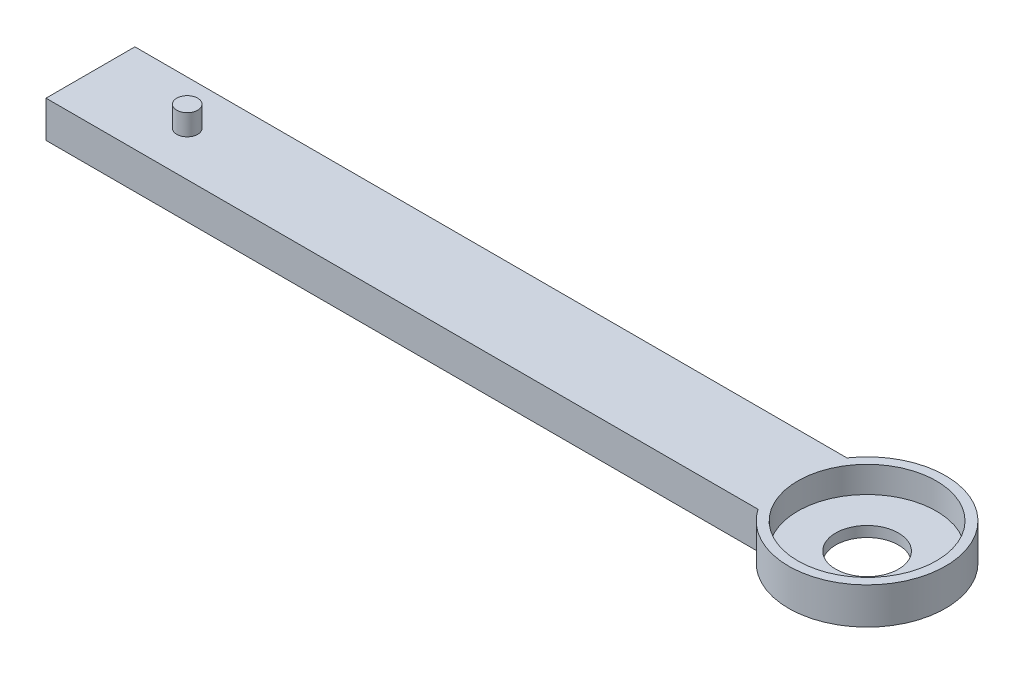
from build123d import *

# Parameters (mm, degrees)
SKETCH_3_W          = 148.5
SKETCH_3_H          = 7
EXTRUDE_1_DEPTH     = 17
SKETCH_4_R          = 15
CUT_EXTRUDE_3_DEPTH = 150.633719462
SKETCH_6_R          = 15
EXTRUDE_2_DEPTH     = 7
SKETCH_7_R          = 13.25
CUT_EXTRUDE_4_DEPTH = 5
SKETCH_8_R          = 6
CUT_EXTRUDE_5_DEPTH = 166.255862226
SKETCH_9_R          = 2
EXTRUDE_3_DEPTH     = 4
CUT_EXTRUDE_7_DEPTH = 1


with BuildPart() as part:
    # ｽｹｯﾁ3 → ﾎﾞｽ - 押し出し1 (new body)
    with BuildSketch(Plane.XY):
        with Locations((74.25, -3.5)):
            Rectangle(SKETCH_3_W, SKETCH_3_H)
    extrude(amount=EXTRUDE_1_DEPTH)

    # ｽｹｯﾁ4 → ｶｯﾄ - 押し出し3 (cut, through all)
    with BuildSketch(Plane(origin=(0, 0, 0), x_dir=(1, 0, 0), z_dir=(0, 1, 0))):
        with Locations((148.5, -8.5)):
            Circle(SKETCH_4_R)
    extrude(amount=-CUT_EXTRUDE_3_DEPTH, mode=Mode.SUBTRACT)

    # ｽｹｯﾁ6 → ﾎﾞｽ - 押し出し2 (add)
    with BuildSketch(Plane(origin=(0, 0, 0), x_dir=(1, 0, 0), z_dir=(0, 1, 0))):
        with Locations((148.5, -8.5)):
            Circle(SKETCH_6_R)
    extrude(amount=-EXTRUDE_2_DEPTH)

    # ｽｹｯﾁ7 → ｶｯﾄ - 押し出し4 (cut)
    with BuildSketch(Plane(origin=(0, 0, 0), x_dir=(1, 0, 0), z_dir=(0, 1, 0))):
        with Locations(Location((148.5, -8.5, 0), (0, 0, 270))):
            Circle(SKETCH_7_R)
    extrude(amount=-CUT_EXTRUDE_4_DEPTH, mode=Mode.SUBTRACT)

    # ｽｹｯﾁ8 → ｶｯﾄ - 押し出し5 (cut, through all)
    with BuildSketch(Plane(origin=(0, -5, 0), x_dir=(1, 0, 0), z_dir=(0, 1, 0))):
        with Locations(Location((148.5, -8.5, 0), (0, 0, 270))):
            Circle(SKETCH_8_R)
    extrude(amount=-CUT_EXTRUDE_5_DEPTH, mode=Mode.SUBTRACT)

    # ｽｹｯﾁ9 → ﾎﾞｽ - 押し出し3 (add)
    with BuildSketch(Plane(origin=(0, 0, 0), x_dir=(1, 0, 0), z_dir=(0, 1, 0))):
        with Locations(Location((18.5, -8.5, 0), (0, 0, 90))):
            Circle(SKETCH_9_R)
    extrude(amount=EXTRUDE_3_DEPTH)

    # ｽｹｯﾁ12 → ｶｯﾄ - 押し出し7 (cut)
    # profile 1 of 2: a face of its own
    with BuildSketch(Plane.XZ.offset(7)):
        with BuildLine():
            Line((8.222746092, 6.351907356), (8.90563872, 6.351907356))
            add(Edge.make_bspline(
                [(8.90563872, 6.351907356), (8.939067198, 6.351731606), (9.003859909, 6.351390958), (9.098079351, 6.346107827), (9.186328161, 6.338904157), (9.268631934, 6.327474064), (9.344952636, 6.313682287), (9.415520273, 6.296980471), (9.480110445, 6.276953857), (9.557223182, 6.245107576), (9.645143843, 6.197784408), (9.740342235, 6.127855843), (9.821746475, 6.042323379), (9.891932792, 5.945840724), (9.947733912, 5.839704952), (9.988103209, 5.726445764), (10.013661084, 5.607524022), (10.016289519, 5.525880844), (10.017617887, 5.484619696)],
                knots=[0, 0, 0, 0, 1.001505555, 1.941167018, 2.826882275, 3.653841531, 4.429895133, 5.150066043, 5.825578002, 6.45369114, 7.647487171, 8.808567382, 9.977351308, 11.170798116, 12.373658725, 13.556498008, 14.765093433, 16, 16, 16, 16], degree=3))
            add(Edge.make_bspline(
                [(10.017617887, 5.484619696), (10.016524668, 5.44596714), (10.014376391, 5.370011223), (9.993833632, 5.258917114), (9.961672963, 5.153165895), (9.916967714, 5.05314351), (9.858865718, 4.961109897), (9.790007399, 4.876322631), (9.706930597, 4.802371574), (9.644687357, 4.761028671), (9.613070611, 4.74002835)],
                knots=[0, 0, 0, 0, 1.044552857, 2.05264487, 3.044412934, 4.028983338, 5.005914585, 5.980388656, 6.974128949, 8, 8, 8, 8], degree=3))
            add(Edge.make_bspline(
                [(9.613070611, 4.74002835), (9.652831039, 4.724763351), (9.728902586, 4.695557627), (9.833588599, 4.643922163), (9.923783444, 4.587760052), (10.00018059, 4.526428202), (10.065518245, 4.460319391), (10.122571186, 4.388464277), (10.17125256, 4.309925519), (10.212965484, 4.225521984), (10.24551424, 4.136115515), (10.269890144, 4.042544739), (10.283857593, 3.945145184), (10.285845235, 3.878859805), (10.286848656, 3.84539694)],
                knots=[0, 0, 0, 0, 1.27268992, 2.434971085, 3.483601985, 4.442670788, 5.356604649, 6.2567628, 7.179492994, 8.113709626, 9.066344395, 10.018646069, 10.999752585, 12, 12, 12, 12], degree=3))
            add(Edge.make_bspline(
                [(10.286848656, 3.84539694), (10.28587181, 3.811230068), (10.283949838, 3.744005789), (10.269769866, 3.645250655), (10.245760759, 3.550875708), (10.212689613, 3.460270526), (10.169527298, 3.373610391), (10.116999334, 3.290797127), (10.05436777, 3.212662796), (9.984304901, 3.138339173), (9.905042756, 3.071511386), (9.819527001, 3.011995679), (9.726680681, 2.963049617), (9.628028687, 2.921933596), (9.522464371, 2.890526397), (9.410461764, 2.868553823), (9.292117462, 2.853748786), (9.210907711, 2.852531581), (9.169260515, 2.851907356)],
                knots=[0, 0, 0, 0, 0.978564426, 1.925352924, 2.850884081, 3.763762016, 4.682927383, 5.618979971, 6.567305752, 7.547517671, 8.540179244, 9.531824382, 10.526200242, 11.540722885, 12.589160233, 13.674978461, 14.80764778, 16, 16, 16, 16], degree=3))
            Line((9.169260515, 2.851907356), (8.222746092, 2.851907356))
            Line((8.222746092, 2.851907356), (8.222746092, 6.351907356))
        make_face()
        with BuildLine():
            Line((8.536848656, 5.992932997), (8.536848656, 4.871138126))
            Line((8.536848656, 4.871138126), (8.747886316, 4.871138126))
            add(Edge.make_bspline(
                [(8.747886316, 4.871138126), (8.778735112, 4.871538049), (8.838341271, 4.872310781), (8.924661168, 4.874524298), (9.004786186, 4.880722342), (9.078578019, 4.886918604), (9.145920463, 4.896993191), (9.206664324, 4.908985314), (9.261762921, 4.92166822), (9.325302467, 4.943237706), (9.397375415, 4.975115382), (9.474208519, 5.024587218), (9.541942989, 5.083511571), (9.599140177, 5.151502533), (9.645951647, 5.226368719), (9.678465362, 5.306915599), (9.700512647, 5.391135731), (9.702504178, 5.448953984), (9.703515323, 5.4783096)],
                knots=[0, 0, 0, 0, 1.156816544, 2.235205308, 3.236616184, 4.169592532, 5.011045266, 5.787822928, 6.49130361, 7.128639758, 8.301311294, 9.436451833, 10.541879658, 11.654887649, 12.756523258, 13.837046038, 14.901820046, 16, 16, 16, 16], degree=3))
            add(Edge.make_bspline(
                [(9.703515323, 5.4783096), (9.702989143, 5.497735371), (9.701956983, 5.535841144), (9.69350368, 5.591390498), (9.679136106, 5.64363425), (9.660681812, 5.693288361), (9.634893124, 5.738800211), (9.60452966, 5.781743406), (9.56784397, 5.820655525), (9.526086657, 5.857025023), (9.478078035, 5.889269551), (9.423846743, 5.917510314), (9.362659066, 5.940251091), (9.295546211, 5.960167243), (9.221475123, 5.974155537), (9.14130057, 5.985808925), (9.054365851, 5.991741667), (8.994220748, 5.99252703), (8.963130707, 5.992932997)],
                knots=[0, 0, 0, 0, 0.91205012, 1.789085906, 2.630437955, 3.453916878, 4.269457761, 5.079663411, 5.91843418, 6.774407191, 7.675494373, 8.627863946, 9.638891023, 10.736472738, 11.911756761, 13.175263542, 14.539845004, 16, 16, 16, 16], degree=3))
            Line((8.963130707, 5.992932997), (8.536848656, 5.992932997))
        make_face(mode=Mode.SUBTRACT)
        with BuildLine():
            Line((8.536848656, 4.512163767), (8.536848656, 3.210881715))
            Line((8.536848656, 3.210881715), (8.984164361, 3.210881715))
            add(Edge.make_bspline(
                [(8.984164361, 3.210881715), (9.016183287, 3.211265463), (9.077895546, 3.212005085), (9.166996776, 3.21441964), (9.24957988, 3.219911915), (9.325268015, 3.228557765), (9.394878468, 3.237936214), (9.457576171, 3.250547495), (9.513869364, 3.264996456), (9.579143672, 3.287330628), (9.652647181, 3.322027099), (9.731858037, 3.374341325), (9.802284255, 3.436664633), (9.862089514, 3.508795547), (9.911102503, 3.587226874), (9.946757958, 3.670372224), (9.968748815, 3.756857752), (9.971410984, 3.815824464), (9.972746092, 3.84539694)],
                knots=[0, 0, 0, 0, 1.160039823, 2.235823828, 3.228722157, 4.157150951, 4.99529583, 5.772374946, 6.472645482, 7.099169577, 8.269452708, 9.405989375, 10.527446681, 11.663510218, 12.788923519, 13.866172445, 14.929861265, 16, 16, 16, 16], degree=3))
            add(Edge.make_bspline(
                [(9.972746092, 3.84539694), (9.972469988, 3.86389028), (9.971922233, 3.900578662), (9.963661618, 3.954494481), (9.951647748, 4.006720354), (9.936116314, 4.057398095), (9.913496847, 4.105611471), (9.887090302, 4.152314031), (9.8561289, 4.19756751), (9.807884734, 4.254779764), (9.73771275, 4.320696777), (9.638005974, 4.385234279), (9.524633676, 4.437282086), (9.442406184, 4.459381562), (9.399929586, 4.470797581)],
                knots=[0, 0, 0, 0, 0.723448775, 1.435228256, 2.130040452, 2.821711965, 3.505591119, 4.210454504, 4.921174351, 5.648778258, 7.137944449, 8.670945889, 10.280296675, 12, 12, 12, 12], degree=3))
            add(Edge.make_bspline(
                [(9.399929586, 4.470797581), (9.38290049, 4.474252665), (9.345977897, 4.481743999), (9.285770317, 4.489651703), (9.217034448, 4.496696763), (9.139611571, 4.50190792), (9.05340373, 4.507294464), (8.958226811, 4.509389285), (8.854469496, 4.511888545), (8.782477124, 4.512069679), (8.745081829, 4.512163767)],
                knots=[0, 0, 0, 0, 0.634451884, 1.375622551, 2.216452059, 3.157844607, 4.20941857, 5.370758133, 6.634282058, 8, 8, 8, 8], degree=3))
            Line((8.745081829, 4.512163767), (8.536848656, 4.512163767))
        make_face(mode=Mode.SUBTRACT)
    # profile 2 of 2: a face of its own
    with BuildSketch(Plane.XZ.offset(7)):
        with BuildLine():
            Line((11.139412759, 5.274984279), (10.825310195, 5.274984279))
            add(Edge.make_bspline(
                [(10.825310195, 5.274984279), (10.827357348, 5.316655167), (10.831377902, 5.398495682), (10.850206191, 5.517819588), (10.877147068, 5.631874387), (10.915238522, 5.739744301), (10.9625448, 5.842383108), (11.019274827, 5.939383124), (11.086468678, 6.030374312), (11.162675412, 6.114513156), (11.245444051, 6.191700727), (11.33474999, 6.258355969), (11.428595018, 6.314673641), (11.526694417, 6.361754883), (11.63015498, 6.397094728), (11.738037838, 6.423316368), (11.850816974, 6.439092714), (11.927656996, 6.440788499), (11.966736477, 6.441650946)],
                knots=[0, 0, 0, 0, 1.10065271, 2.161652631, 3.183658789, 4.190468796, 5.17591951, 6.163126047, 7.15150782, 8.156236427, 9.156009102, 10.134482811, 11.092018607, 12.041330605, 13.001268258, 13.972401359, 14.968799086, 16, 16, 16, 16], degree=3))
            add(Edge.make_bspline(
                [(11.966736477, 6.441650946), (12.005114551, 6.44075249), (12.080526095, 6.438987055), (12.19058811, 6.423826026), (12.295365404, 6.400080434), (12.394653171, 6.366765018), (12.487659235, 6.32198059), (12.57508228, 6.268183052), (12.657963091, 6.20596322), (12.732569874, 6.132709407), (12.801077954, 6.054507022), (12.860180209, 5.971019119), (12.910793372, 5.884789833), (12.952981052, 5.795161631), (12.984037191, 5.701290603), (13.007615399, 5.6045434), (13.020942813, 5.503918589), (13.022988236, 5.435812033), (13.024028143, 5.401186202)],
                knots=[0, 0, 0, 0, 1.111607364, 2.184268762, 3.212621178, 4.221274766, 5.211760367, 6.196651075, 7.1921475, 8.207485113, 9.220403448, 10.201281604, 11.166441695, 12.114753415, 13.065576456, 14.026450734, 14.996634279, 16, 16, 16, 16], degree=3))
            add(Edge.make_bspline(
                [(13.024028143, 5.401186202), (13.02233488, 5.352438368), (13.018978069, 5.255798154), (12.990263693, 5.113783291), (12.945417181, 4.976189872), (12.891419825, 4.86545257), (12.83694738, 4.776219077), (12.787859873, 4.702750372), (12.730395062, 4.623644903), (12.663716564, 4.539167566), (12.589203692, 4.448656661), (12.506181528, 4.352166865), (12.414058046, 4.250695096), (12.349399546, 4.181389494), (12.31589513, 4.145477068)],
                knots=[0, 0, 0, 0, 1.184426356, 2.348067706, 3.509069118, 4.696110526, 5.333549288, 6.050745305, 6.844228056, 7.710549037, 8.667450064, 9.695053472, 10.805634456, 12, 12, 12, 12], degree=3))
            Line((12.31589513, 4.145477068), (11.440194009, 3.210881715))
            Line((11.440194009, 3.210881715), (13.068899938, 3.210881715))
            Line((13.068899938, 3.210881715), (13.068899938, 2.851907356))
            Line((13.068899938, 2.851907356), (10.69069481, 2.851907356))
            Line((10.69069481, 2.851907356), (12.048066605, 4.300424985))
            add(Edge.make_bspline(
                [(12.048066605, 4.300424985), (12.081114492, 4.334923291), (12.144592719, 4.401187478), (12.234375296, 4.497930438), (12.315014284, 4.587679979), (12.387031677, 4.670266527), (12.448865182, 4.746898095), (12.503737414, 4.815092798), (12.547703005, 4.877847249), (12.595418401, 4.950587863), (12.641632382, 5.03940018), (12.681344738, 5.147933869), (12.705559587, 5.259661122), (12.708464422, 5.335163159), (12.709925579, 5.373141331)],
                knots=[0, 0, 0, 0, 1.329631726, 2.553950428, 3.673215718, 4.687767853, 5.603093632, 6.413772471, 7.123043292, 7.734684054, 8.834405432, 9.900288307, 10.943827018, 12, 12, 12, 12], degree=3))
            add(Edge.make_bspline(
                [(12.709925579, 5.373141331), (12.709289837, 5.397022729), (12.708036911, 5.444088379), (12.696979213, 5.513094138), (12.680268707, 5.579658952), (12.656323449, 5.643987571), (12.624716709, 5.705433223), (12.586243329, 5.764070704), (12.541853266, 5.820759669), (12.490501996, 5.873912967), (12.434090477, 5.922594172), (12.374496227, 5.965718258), (12.311446123, 6.001757369), (12.245206001, 6.031300866), (12.175960531, 6.054476247), (12.103575786, 6.070534826), (12.02825177, 6.08061731), (11.976818274, 6.081981482), (11.950610675, 6.082676587)],
                knots=[0, 0, 0, 0, 0.991446411, 1.95395049, 2.89581595, 3.838931463, 4.798493298, 5.75982156, 6.748411868, 7.785213223, 8.824556874, 9.840280684, 10.836137867, 11.835679398, 12.848801643, 13.863922112, 14.911575587, 16, 16, 16, 16], degree=3))
            add(Edge.make_bspline(
                [(11.950610675, 6.082676587), (11.923239843, 6.081961555), (11.869488046, 6.08055735), (11.790569013, 6.070734686), (11.715283236, 6.053788845), (11.643441333, 6.030612171), (11.574921747, 6.001153622), (11.510057703, 5.964461877), (11.448994814, 5.920678384), (11.39161829, 5.871037828), (11.338754311, 5.815770227), (11.292307436, 5.754160263), (11.251723421, 5.687332848), (11.216314188, 5.615468298), (11.187558498, 5.537914518), (11.165585347, 5.454946813), (11.148198501, 5.366925431), (11.14238998, 5.306140346), (11.139412759, 5.274984279)],
                knots=[0, 0, 0, 0, 1.031018746, 2.02475058, 2.990194455, 3.934040569, 4.864654155, 5.795059489, 6.735614925, 7.690564532, 8.649604399, 9.611025574, 10.590972636, 11.591080095, 12.624614302, 13.701020113, 14.821632451, 16, 16, 16, 16], degree=3))
        make_face()
    extrude(amount=-CUT_EXTRUDE_7_DEPTH, mode=Mode.SUBTRACT)


solid = part.part
